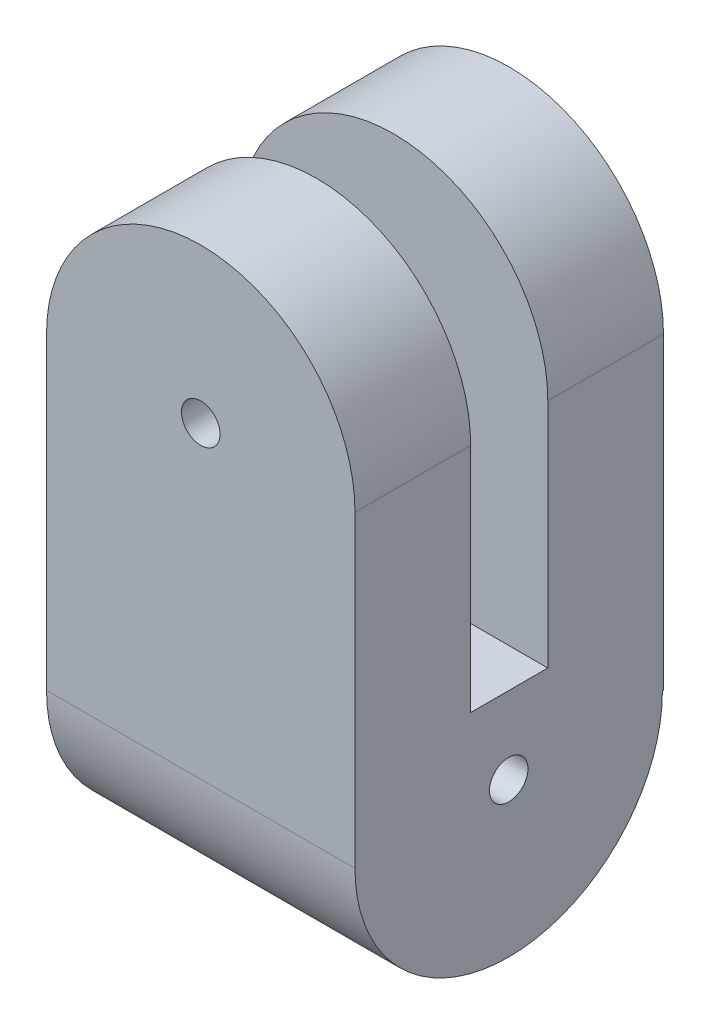
from build123d import *

# Parameters (mm, degrees)
BOSS_EXTRUDE1_DEPTH = 10
SKETCH2_W           = 5
SKETCH2_H           = 25
CUT_EXTRUDE1_DEPTH  = 10
SKETCH3_R           = 1.25
CUT_EXTRUDE2_DEPTH  = 27.925824036
BOSS_EXTRUDE3_DEPTH = 20
SKETCH7_R           = 1.25
CUT_EXTRUDE3_DEPTH  = 20


with BuildPart() as part:
    # Sketch1 → Boss-Extrude1 (new, symmetric)
    with BuildSketch(Plane.XY):
        with BuildLine():
            Line((-10, -15), (10, -15))
            Line((10, -15), (10, 5))
            ThreePointArc((10, 5), (0, 15), (-10, 5))
            Line((-10, 5), (-10, -15))
        make_face()
    extrude(amount=BOSS_EXTRUDE1_DEPTH, both=True)

    # Sketch2 → Cut-Extrude1 (cut, symmetric)
    with BuildSketch(Plane(origin=(0, 0, 0), x_dir=(0, 0, -1), z_dir=(1, 0, 0))):
        with Locations((0, 2.5)):
            Rectangle(SKETCH2_W, SKETCH2_H)
    extrude(amount=CUT_EXTRUDE1_DEPTH, both=True, mode=Mode.SUBTRACT)

    # Sketch3 → Cut-Extrude2 (cut, through all)
    with BuildSketch(Plane.XY.offset(10)):
        with Locations((0, 5)):
            Circle(SKETCH3_R)
    extrude(amount=-CUT_EXTRUDE2_DEPTH, mode=Mode.SUBTRACT)

    # Sketch6 → Boss-Extrude3 (add)
    with BuildSketch(Plane(origin=(10, 0, 0), x_dir=(0, 0, -1), z_dir=(1, 0, 0))):
        with BuildLine():
            Line((-10, -15), (9.932520062, -15))
            ThreePointArc((9.932520062, -15), (-0.033739969, -24.966260031), (-10, -15))
        make_face()
    extrude(amount=-BOSS_EXTRUDE3_DEPTH)

    # Sketch7 → Cut-Extrude3 (cut)
    with BuildSketch(Plane(origin=(10, 0, 0), x_dir=(0, 0, -1), z_dir=(1, 0, 0))):
        with Locations((-0.033739969, -15)):
            Circle(SKETCH7_R)
    extrude(amount=-CUT_EXTRUDE3_DEPTH, mode=Mode.SUBTRACT)


solid = part.part
